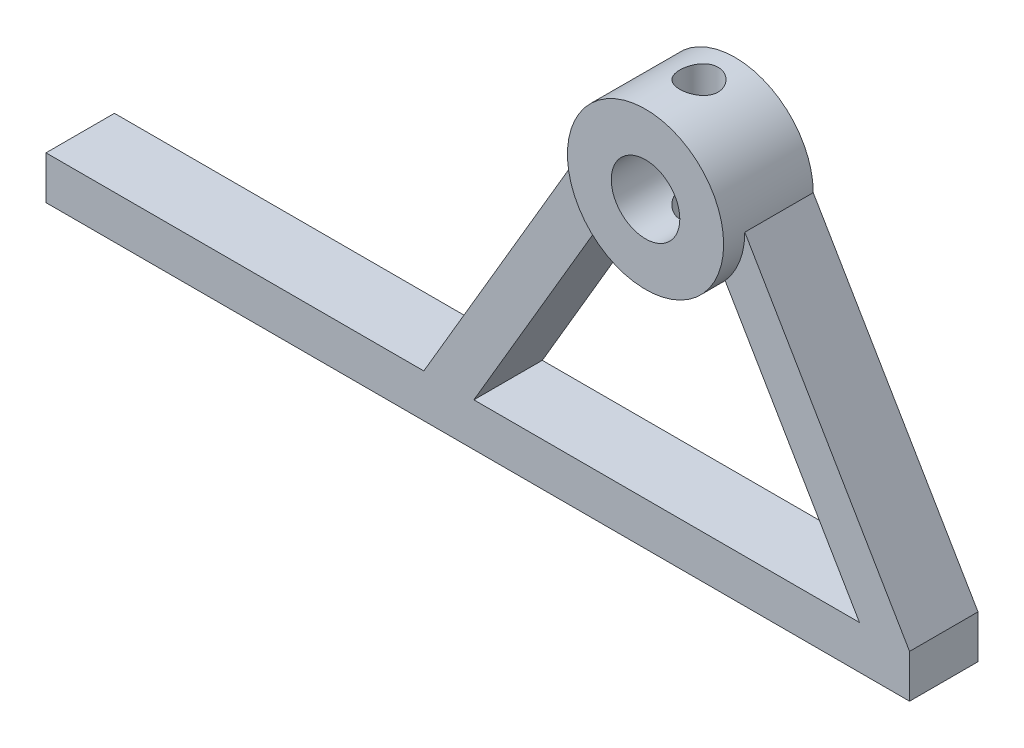
from build123d import *

# Parameters (mm, degrees)
SKETCH1_R               = 3.175
BOSS_EXTRUDE1_DEPTH     = 6.34
CUT_EXTRUDE1_DEPTH      = 4.34
CUT_EXTRUDE1_DEPTH_BACK = 18.34
SKETCH2_R               = 1.775
SKETCH5_R               = 7.235705293
SKETCH5_R_2             = 3.175
BOSS_EXTRUDE2_DEPTH     = 1.96
SKETCH6_W               = 6.34
SKETCH6_H               = 4
BOSS_EXTRUDE3_DEPTH     = 35


with BuildPart() as part:
    # Sketch1 → Boss-Extrude1 (new body)
    with BuildSketch(Plane.XY):
        with BuildLine():
            Line((-7.235705295, 8.319966171), (-22.5, -17.680033829))
            Line((-22.5, -17.680033829), (-22.5, -21.680033829))
            Line((-22.5, -21.680033829), (22.5, -21.680033829))
            Line((22.5, -21.680033829), (22.5, -17.680033829))
            Line((22.5, -17.680033829), (7.235705295, 8.319966171))
            ThreePointArc((7.235705293, 8.319966171), (0, 15.555671463), (-7.235705293, 8.319966171))
        make_face()
        with BuildLine():
            Line((-17.861599202, -17.680033829), (-5.414947439, 3.520614619))
            ThreePointArc((-5.414947439, 3.520614619), (0, 1.084260878), (5.414947439, 3.520614619))
            Line((5.414947439, 3.520614619), (17.861599202, -17.680033829))
            Line((17.861599202, -17.680033829), (-17.861599202, -17.680033829))
        make_face(mode=Mode.SUBTRACT)
        with Locations((0, 8.319966171)):
            Circle(SKETCH1_R, mode=Mode.SUBTRACT)
    extrude(amount=BOSS_EXTRUDE1_DEPTH)

    # Sketch2 → Cut-Extrude1 (cut, two sides: drawn at the far end of the back side and taken through both)
    with BuildSketch(Plane(origin=(0, 14.319966171, 0), x_dir=(1, 0, 0), z_dir=(0, 1, 0)).offset(-CUT_EXTRUDE1_DEPTH_BACK)):
        with Locations(Location((0, -3.35, 0), (0, 0, 90))):
            Circle(SKETCH2_R)
    extrude(amount=CUT_EXTRUDE1_DEPTH + CUT_EXTRUDE1_DEPTH_BACK, mode=Mode.SUBTRACT)

    # Sketch5 → Boss-Extrude2 (add)
    with BuildSketch(Plane.XY.offset(6.34)):
        with Locations((0, 8.319966171)):
            Circle(SKETCH5_R)
        with Locations((0, 8.319966171)):
            Circle(SKETCH5_R_2, mode=Mode.SUBTRACT)
    extrude(amount=BOSS_EXTRUDE2_DEPTH)

    # Sketch6 → Boss-Extrude3 (add)
    with BuildSketch(Plane.ZY.offset(22.5)):
        with Locations((3.17, -19.680033829)):
            Rectangle(SKETCH6_W, SKETCH6_H)
    extrude(amount=BOSS_EXTRUDE3_DEPTH)


solid = part.part
